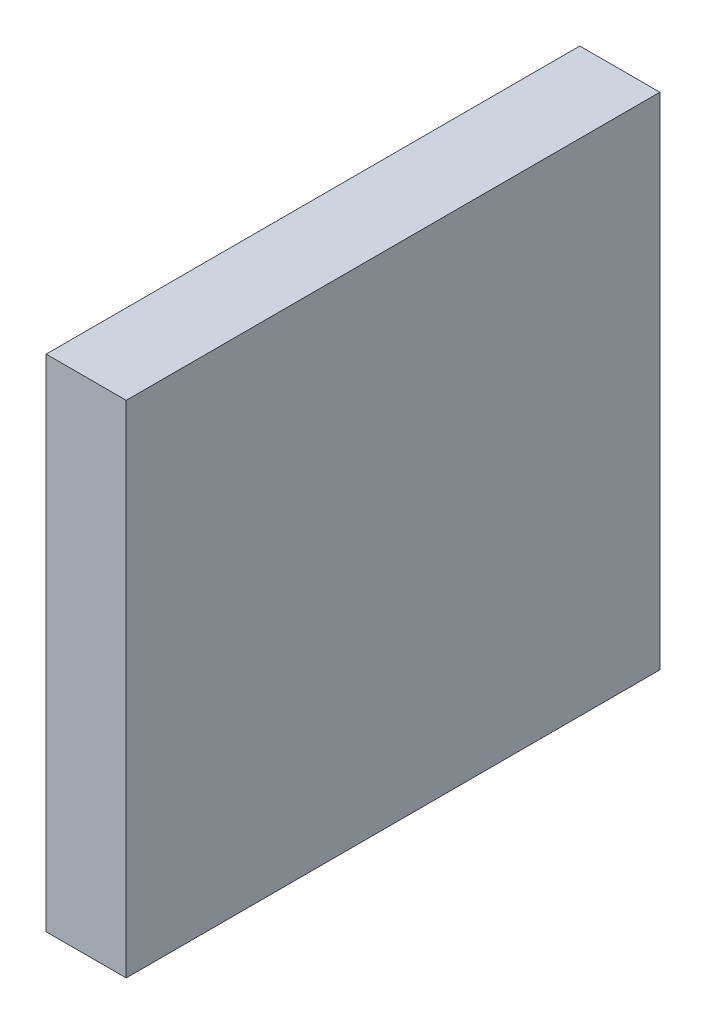
from build123d import *

# Parameters (mm, degrees)
SKETCH1_W           = 14.4
SKETCH1_H           = 90
BOSS_EXTRUDE1_DEPTH = 96


with BuildPart() as part:
    # Sketch1 → Boss-Extrude1 (new body)
    with BuildSketch(Plane.XY):
        with Locations((7.2, 45)):
            Rectangle(SKETCH1_W, SKETCH1_H)
    extrude(amount=BOSS_EXTRUDE1_DEPTH)


solid = part.part
